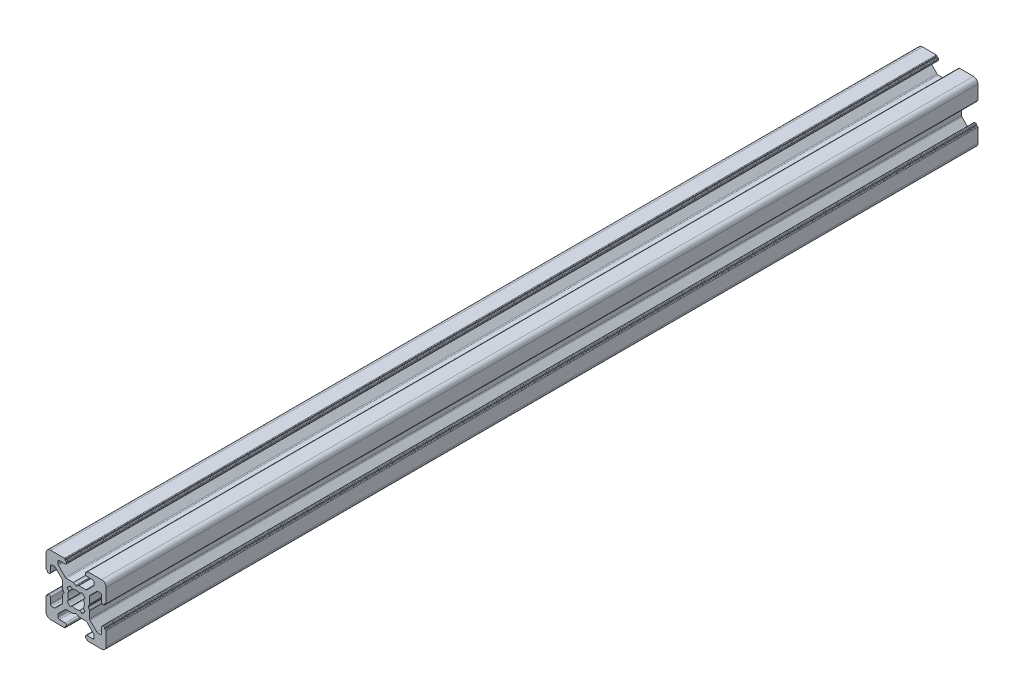
from build123d import *

# Parameters (mm, degrees)
AUFSATZ_LINEAR_AUSTRAGEN1_DEPTH = 290


with BuildPart() as part:
    # Skizze1 → Aufsatz-Linear austragen1 (new body)
    with BuildSketch(Plane.XY.offset(1000)):
        with BuildLine():
            Line((4.849999772, 19.5), (4.849999772, 19.8))
            ThreePointArc((4.849999772, 19.8), (4.791421129, 19.941421356), (4.649999773, 20))
            Line((4.649999773, 20), (0, 20))
            ThreePointArc((0, 20), (-1.060660172, 19.560660172), (-1.5, 18.5))
            Line((-1.5, 18.5), (-1.5, 13.849999605))
            ThreePointArc((-1.5, 13.849999605), (-1.441421356, 13.708578248), (-1.3, 13.649999605))
            Line((-1.3, 13.649999605), (-0.999999732, 13.649999605))
            Line((-0.999999732, 13.649999605), (-0.999999732, 13.3))
            ThreePointArc((-0.999999732, 13.3), (-0.941421088, 13.158578644), (-0.799999732, 13.1))
            Line((-0.799999732, 13.1), (-0.499999732, 13.1))
            ThreePointArc((-0.499999732, 13.1), (-0.146446341, 13.246446609), (2.68e-07, 13.6))
            Line((2.68e-07, 13.6), (2.68e-07, 15.499999605))
            ThreePointArc((2.68e-07, 15.499999605), (0.146446877, 15.853552995), (0.500000268, 15.999999605))
            Line((0.500000268, 15.999999605), (1.232233315, 15.999999605))
            ThreePointArc((1.232233315, 15.999999605), (1.423575031, 15.961939371), (1.585786706, 15.853552995))
            Line((1.585786706, 15.853552995), (3.853553602, 13.585786099))
            ThreePointArc((3.853553602, 13.585786099), (3.961939977, 13.423574425), (4.000000211, 13.232232708))
            Line((4.000000211, 13.232232708), (4.000000211, 10.953589302))
            ThreePointArc((4.000000211, 10.953589302), (4.006815047, 10.90182549), (4.026795133, 10.853589298))
            Line((4.026795133, 10.853589298), (4.461880159, 10.099999969))
            ThreePointArc((4.461880159, 10.099999969), (4.488675071, 10), (4.461880159, 9.900000031))
            Line((4.461880159, 9.900000031), (4.026795133, 9.146410702))
            ThreePointArc((4.026795133, 9.146410702), (4.006815047, 9.09817451), (4.000000211, 9.046410698))
            Line((4.000000211, 9.046410698), (4.000000211, 6.767767292))
            ThreePointArc((4.000000211, 6.767767292), (3.961939977, 6.576425575), (3.853553602, 6.414213901))
            Line((3.853553602, 6.414213901), (1.585786706, 4.146447005))
            ThreePointArc((1.585786706, 4.146447005), (1.423575031, 4.038060629), (1.232233315, 4.000000395))
            Line((1.232233315, 4.000000395), (0.500000268, 4.000000395))
            ThreePointArc((0.500000268, 4.000000395), (0.146446877, 4.146447005), (2.68e-07, 4.500000395))
            Line((2.68e-07, 4.500000395), (2.68e-07, 6.4))
            ThreePointArc((2.68e-07, 6.4), (-0.146446341, 6.753553391), (-0.499999732, 6.9))
            Line((-0.499999732, 6.9), (-0.799999732, 6.9))
            ThreePointArc((-0.799999732, 6.9), (-0.941421088, 6.841421356), (-0.999999732, 6.7))
            Line((-0.999999732, 6.7), (-0.999999732, 6.350000395))
            Line((-0.999999732, 6.350000395), (-1.3, 6.350000395))
            ThreePointArc((-1.3, 6.350000395), (-1.441421356, 6.291421752), (-1.5, 6.150000395))
            Line((-1.5, 6.150000395), (-1.5, 1.5))
            ThreePointArc((-1.5, 1.5), (-1.060660172, 0.439339828), (0, 0))
            Line((0, 0), (4.649999772, 0))
            ThreePointArc((4.649999772, 0), (4.791421129, 0.058578644), (4.849999772, 0.2))
            Line((4.849999772, 0.2), (4.849999772, 0.5))
            Line((4.849999772, 0.5), (5.2, 0.5))
            ThreePointArc((5.2, 0.5), (5.341421356, 0.558578644), (5.4, 0.7))
            Line((5.4, 0.7), (5.4, 1.000000327))
            ThreePointArc((5.4, 1.000000327), (5.253553391, 1.353553717), (4.9, 1.500000327))
            Line((4.9, 1.500000327), (2.999999314, 1.500000327))
            ThreePointArc((2.999999314, 1.500000327), (2.646445923, 1.646446936), (2.499999314, 2.000000327))
            Line((2.499999314, 2.000000327), (2.499999314, 2.732233374))
            ThreePointArc((2.499999314, 2.732233374), (2.538059552, 2.923575101), (2.646445941, 3.085786782))
            Line((2.646445941, 3.085786782), (4.914212788, 5.353553408))
            ThreePointArc((4.914212788, 5.353553408), (5.076424456, 5.461939771), (5.267766161, 5.5))
            Line((5.267766161, 5.5), (7.546409688, 5.5))
            ThreePointArc((7.546409688, 5.5), (7.598173495, 5.506814834), (7.646409684, 5.526794917))
            Line((7.646409684, 5.526794917), (8.399999955, 5.961880438))
            ThreePointArc((8.399999955, 5.961880438), (8.5, 5.988675368), (8.600000045, 5.961880438))
            Line((8.600000045, 5.961880438), (9.353590316, 5.526794917))
            ThreePointArc((9.353590316, 5.526794917), (9.401826505, 5.506814834), (9.453590312, 5.5))
            Line((9.453590312, 5.5), (11.73223292, 5.5))
            ThreePointArc((11.73223292, 5.5), (11.923574636, 5.461939766), (12.08578631, 5.353553391))
            Line((12.08578631, 5.353553391), (14.353554077, 3.085785624))
            ThreePointArc((14.353554077, 3.085785624), (14.461940452, 2.92357395), (14.500000686, 2.732232234))
            Line((14.500000686, 2.732232234), (14.500000686, 2.000000327))
            ThreePointArc((14.500000686, 2.000000327), (14.353554077, 1.646446936), (14.000000686, 1.500000327))
            Line((14.000000686, 1.500000327), (12.1, 1.500000327))
            ThreePointArc((12.1, 1.500000327), (11.746446609, 1.353553717), (11.6, 1.000000327))
            Line((11.6, 1.000000327), (11.6, 0.7))
            ThreePointArc((11.6, 0.7), (11.658578644, 0.558578644), (11.8, 0.5))
            Line((11.8, 0.5), (12.150000227, 0.5))
            Line((12.150000227, 0.5), (12.150000227, 0.2))
            ThreePointArc((12.150000227, 0.2), (12.208578871, 0.058578644), (12.350000227, 0))
            Line((12.350000227, 0), (17, 0))
            ThreePointArc((17, 0), (18.060660172, 0.439339828), (18.5, 1.5))
            Line((18.5, 1.5), (18.5, 6.150000395))
            ThreePointArc((18.5, 6.150000395), (18.441421356, 6.291421752), (18.3, 6.350000395))
            Line((18.3, 6.350000395), (17.999999732, 6.350000395))
            Line((17.999999732, 6.350000395), (17.999999732, 6.7))
            ThreePointArc((17.999999732, 6.7), (17.941421088, 6.841421356), (17.799999732, 6.9))
            Line((17.799999732, 6.9), (17.499999732, 6.9))
            ThreePointArc((17.499999732, 6.9), (17.146446341, 6.753553391), (16.999999732, 6.4))
            Line((16.999999732, 6.4), (16.999999732, 4.500000395))
            ThreePointArc((16.999999732, 4.500000395), (16.853553123, 4.146447005), (16.499999732, 4.000000395))
            Line((16.499999732, 4.000000395), (15.767766789, 4.000000395))
            ThreePointArc((15.767766789, 4.000000395), (15.576425084, 4.038060624), (15.414213416, 4.146446988))
            Line((15.414213416, 4.146446988), (13.146446415, 6.414213767))
            ThreePointArc((13.146446415, 6.414213767), (13.038060027, 6.576425447), (12.999999789, 6.767767175))
            Line((12.999999789, 6.767767175), (12.999999789, 9.046410698))
            ThreePointArc((12.999999789, 9.046410698), (12.993184953, 9.09817451), (12.973204867, 9.146410703))
            Line((12.973204867, 9.146410703), (12.538119841, 9.900000031))
            ThreePointArc((12.538119841, 9.900000031), (12.511324929, 10), (12.538119841, 10.099999969))
            Line((12.538119841, 10.099999969), (12.973204867, 10.853589298))
            ThreePointArc((12.973204867, 10.853589298), (12.993184953, 10.90182549), (12.999999789, 10.953589302))
            Line((12.999999789, 10.953589302), (12.999999789, 13.232232825))
            ThreePointArc((12.999999789, 13.232232825), (13.038060027, 13.423574553), (13.146446415, 13.585786233))
            Line((13.146446415, 13.585786233), (15.414213416, 15.853553012))
            ThreePointArc((15.414213416, 15.853553012), (15.576425084, 15.961939376), (15.767766789, 15.999999605))
            Line((15.767766789, 15.999999605), (16.499999732, 15.999999605))
            ThreePointArc((16.499999732, 15.999999605), (16.853553123, 15.853552995), (16.999999732, 15.499999605))
            Line((16.999999732, 15.499999605), (16.999999732, 13.6))
            ThreePointArc((16.999999732, 13.6), (17.146446341, 13.246446609), (17.499999732, 13.1))
            Line((17.499999732, 13.1), (17.799999732, 13.1))
            ThreePointArc((17.799999732, 13.1), (17.941421088, 13.158578644), (17.999999732, 13.3))
            Line((17.999999732, 13.3), (17.999999732, 13.649999605))
            Line((17.999999732, 13.649999605), (18.3, 13.649999605))
            ThreePointArc((18.3, 13.649999605), (18.441421356, 13.708578248), (18.5, 13.849999605))
            Line((18.5, 13.849999605), (18.5, 18.5))
            ThreePointArc((18.5, 18.5), (18.060660172, 19.560660172), (17, 20))
            Line((17, 20), (12.350000227, 20))
            ThreePointArc((12.350000227, 20), (12.208578871, 19.941421356), (12.150000227, 19.8))
            Line((12.150000227, 19.8), (12.150000227, 19.5))
            Line((12.150000227, 19.5), (11.8, 19.5))
            ThreePointArc((11.8, 19.5), (11.658578644, 19.441421356), (11.6, 19.3))
            Line((11.6, 19.3), (11.6, 18.999999673))
            ThreePointArc((11.6, 18.999999673), (11.746446609, 18.646446283), (12.1, 18.499999673))
            Line((12.1, 18.499999673), (14.000000686, 18.499999673))
            ThreePointArc((14.000000686, 18.499999673), (14.353554077, 18.353553064), (14.500000686, 17.999999673))
            Line((14.500000686, 17.999999673), (14.500000686, 17.267767766))
            ThreePointArc((14.500000686, 17.267767766), (14.461940452, 17.07642605), (14.353554077, 16.914214376))
            Line((14.353554077, 16.914214376), (12.08578631, 14.646446609))
            ThreePointArc((12.08578631, 14.646446609), (11.923574636, 14.538060234), (11.73223292, 14.5))
            Line((11.73223292, 14.5), (9.453590312, 14.5))
            ThreePointArc((9.453590312, 14.5), (9.401826505, 14.493185166), (9.353590316, 14.473205083))
            Line((9.353590316, 14.473205083), (8.600000045, 14.038119562))
            ThreePointArc((8.600000045, 14.038119562), (8.5, 14.011324632), (8.399999955, 14.038119562))
            Line((8.399999955, 14.038119562), (7.646409684, 14.473205083))
            ThreePointArc((7.646409684, 14.473205083), (7.598173495, 14.493185166), (7.546409688, 14.5))
            Line((7.546409688, 14.5), (5.267766161, 14.5))
            ThreePointArc((5.267766161, 14.5), (5.076424456, 14.538060229), (4.914212788, 14.646446592))
            Line((4.914212788, 14.646446592), (2.646445941, 16.914213218))
            ThreePointArc((2.646445941, 16.914213218), (2.538059552, 17.076424899), (2.499999314, 17.267766626))
            Line((2.499999314, 17.267766626), (2.499999314, 17.999999673))
            ThreePointArc((2.499999314, 17.999999673), (2.646445923, 18.353553064), (2.999999314, 18.499999673))
            Line((2.999999314, 18.499999673), (4.9, 18.499999673))
            ThreePointArc((4.9, 18.499999673), (5.253553391, 18.646446283), (5.4, 18.999999673))
            Line((5.4, 18.999999673), (5.4, 19.3))
            ThreePointArc((5.4, 19.3), (5.341421356, 19.441421356), (5.2, 19.5))
            Line((5.2, 19.5), (4.849999772, 19.5))
        make_face()
        with BuildLine():
            Line((6.054704577, 11.258185317), (5.507825047, 11.909930962))
            ThreePointArc((5.507825047, 11.909930962), (5.988262739, 12.508410485), (6.58610498, 12.989640962))
            Line((6.58610498, 12.989640962), (7.241814564, 12.445295362))
            ThreePointArc((7.241814564, 12.445295362), (8.5, 12.75), (9.758185436, 12.445295362))
            Line((9.758185436, 12.445295362), (10.41389502, 12.989640962))
            ThreePointArc((10.41389502, 12.989640962), (11.011737261, 12.508410485), (11.492174953, 11.909930962))
            Line((11.492174953, 11.909930962), (10.945295423, 11.258185317))
            ThreePointArc((10.945295423, 11.258185317), (11.25, 10), (10.945295423, 8.741814683))
            Line((10.945295423, 8.741814683), (11.492174953, 8.090069038))
            ThreePointArc((11.492174953, 8.090069038), (11.011737261, 7.491589515), (10.413895019, 7.010359038))
            Line((10.413895019, 7.010359038), (9.758185436, 7.554704638))
            ThreePointArc((9.758185436, 7.554704638), (8.5, 7.25), (7.241814564, 7.554704638))
            Line((7.241814564, 7.554704638), (6.58610498, 7.010359038))
            ThreePointArc((6.58610498, 7.010359038), (5.988262739, 7.491589515), (5.507825047, 8.090069038))
            Line((5.507825047, 8.090069038), (6.054704577, 8.741814683))
            ThreePointArc((6.054704577, 8.741814683), (5.75, 10), (6.054704577, 11.258185317))
        make_face(mode=Mode.SUBTRACT)
    extrude(amount=-AUFSATZ_LINEAR_AUSTRAGEN1_DEPTH)


solid = part.part
